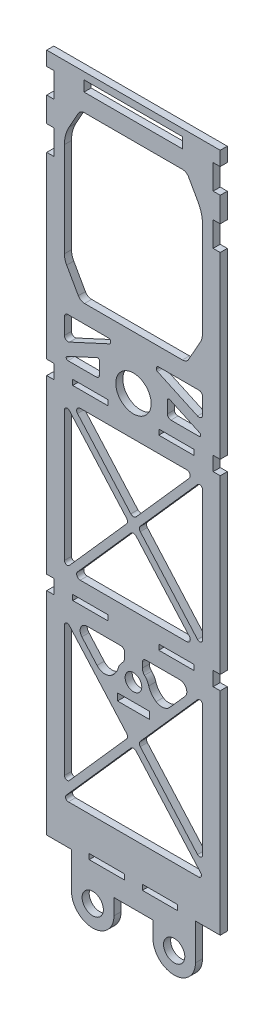
from build123d import *

# Parameters (mm, degrees)
SKETCH_1_R      = 3
SKETCH_1_R_2    = 2.35
SKETCH_1_R_3    = 5
EXTRUDE_1_DEPTH = 2


with BuildPart() as part:
    # 草图1 → 凸台-拉伸1 (new body)
    with BuildSketch(Plane.XY):
        with BuildLine():
            Line((2416.026053977, 1362.44001093), (2391.526053977, 1362.44001093))
            Line((2391.526053977, 1362.44001093), (2391.526053977, 1358.44001093))
            Line((2391.526053977, 1358.44001093), (2393.026053977, 1358.44001093))
            Line((2393.026053977, 1358.44001093), (2393.526053977, 1358.44001093))
            Line((2393.526053977, 1358.44001093), (2393.526053977, 1351.44001093))
            Line((2393.526053977, 1351.44001093), (2391.526053977, 1351.44001093))
            Line((2391.526053977, 1351.44001093), (2391.526053977, 1349.94001093))
            Line((2391.526053977, 1349.94001093), (2391.526053977, 1344.44001093))
            Line((2391.526053977, 1344.44001093), (2393.526053977, 1344.44001093))
            Line((2393.526053977, 1344.44001093), (2393.526053977, 1337.44001093))
            Line((2393.526053977, 1337.44001093), (2391.526053977, 1337.44001093))
            Line((2391.526053977, 1337.44001093), (2391.526053977, 1288.34001093))
            Line((2391.526053977, 1288.34001093), (2391.526053977, 1286.84001093))
            Line((2391.526053977, 1286.84001093), (2393.526053977, 1286.84001093))
            Line((2393.526053977, 1286.84001093), (2393.526053977, 1284.84001093))
            Line((2393.526053977, 1284.84001093), (2393.526053977, 1282.84001093))
            Line((2393.526053977, 1282.84001093), (2391.526053977, 1282.84001093))
            Line((2391.526053977, 1282.84001093), (2391.526053977, 1281.34001093))
            Line((2391.526053977, 1281.34001093), (2391.526053977, 1251.470979848))
            Line((2391.526053977, 1251.470979848), (2391.526053977, 1234.24001093))
            Line((2391.526053977, 1234.24001093), (2393.526053977, 1234.24001093))
            Line((2393.526053977, 1234.24001093), (2393.526053977, 1230.24001093))
            Line((2393.526053977, 1230.24001093), (2391.526053977, 1230.24001093))
            Line((2391.526053977, 1230.24001093), (2391.526053977, 1204.44001093))
            Line((2391.526053977, 1204.44001093), (2391.526053977, 1170.44001093))
            Line((2391.526053977, 1170.44001093), (2398.526053977, 1170.44001093))
            Line((2398.526053977, 1170.44001093), (2398.526053977, 1160.200708018))
            ThreePointArc((2398.526053977, 1160.200708018), (2404.526053977, 1154.200708018), (2410.526053977, 1160.200708018))
            Line((2410.526053977, 1160.200708018), (2410.526053977, 1164.680708018))
            Line((2410.526053977, 1164.680708018), (2416.026053977, 1164.680708018))
            Line((2416.026053977, 1164.680708018), (2421.526053977, 1164.680708018))
            Line((2421.526053977, 1164.680708018), (2421.526053977, 1160.200708018))
            ThreePointArc((2421.526053977, 1160.200708018), (2427.526053977, 1154.200708018), (2433.526053977, 1160.200708018))
            Line((2433.526053977, 1160.200708018), (2433.526053977, 1165.96001093))
            Line((2433.526053977, 1165.96001093), (2433.526053977, 1170.44001093))
            Line((2433.526053977, 1170.44001093), (2440.526053977, 1170.44001093))
            Line((2440.526053977, 1170.44001093), (2440.526053977, 1204.44001093))
            Line((2440.526053977, 1204.44001093), (2440.526053977, 1230.24001093))
            Line((2440.526053977, 1230.24001093), (2438.526053977, 1230.24001093))
            Line((2438.526053977, 1230.24001093), (2438.526053977, 1234.24001093))
            Line((2438.526053977, 1234.24001093), (2440.526053977, 1234.24001093))
            Line((2440.526053977, 1234.24001093), (2440.526053977, 1239.685823227))
            Line((2440.526053977, 1239.685823227), (2440.526053977, 1282.84001093))
            Line((2440.526053977, 1282.84001093), (2438.526053977, 1282.84001093))
            Line((2438.526053977, 1282.84001093), (2438.526053977, 1286.84001093))
            Line((2438.526053977, 1286.84001093), (2440.526053977, 1286.84001093))
            Line((2440.526053977, 1286.84001093), (2440.526053977, 1337.44001093))
            Line((2440.526053977, 1337.44001093), (2438.526053977, 1337.44001093))
            Line((2438.526053977, 1337.44001093), (2438.526053977, 1344.44001093))
            Line((2438.526053977, 1344.44001093), (2440.526053977, 1344.44001093))
            Line((2440.526053977, 1344.44001093), (2440.526053977, 1351.44001093))
            Line((2440.526053977, 1351.44001093), (2438.526053977, 1351.44001093))
            Line((2438.526053977, 1351.44001093), (2438.526053977, 1358.44001093))
            Line((2438.526053977, 1358.44001093), (2440.526053977, 1358.44001093))
            Line((2440.526053977, 1358.44001093), (2440.526053977, 1362.44001093))
            Line((2440.526053977, 1362.44001093), (2416.026053977, 1362.44001093))
        make_face()
        with Locations((2404.526053977, 1160.200708018)):
            Circle(SKETCH_1_R, mode=Mode.SUBTRACT)
        Polygon((2413.526053977, 1171.19001093), (2413.526053977, 1170.44001093), (2403.526053977, 1170.44001093), (2403.526053977, 1171.94001093), (2413.526053977, 1171.94001093), align=None, mode=Mode.SUBTRACT)
        with BuildLine():
            ThreePointArc((2396.526053977, 1224.358954227), (2397.042610992, 1225.107058547), (2397.925204163, 1224.889066531))
            Line((2397.925204163, 1224.889066531), (2414.104542733, 1206.60265131))
            ThreePointArc((2414.104542733, 1206.60265131), (2414.355605001, 1205.94001093), (2414.104542733, 1205.277370549))
            Line((2414.104542733, 1205.277370549), (2397.925204163, 1186.990955328))
            ThreePointArc((2397.925204163, 1186.990955328), (2397.042610992, 1186.772963312), (2396.526053977, 1187.521067633))
            Line((2396.526053977, 1187.521067633), (2396.526053977, 1217.24001093))
            Line((2396.526053977, 1217.24001093), (2396.526053977, 1224.358954227))
        make_face(mode=Mode.SUBTRACT)
        with BuildLine():
            Line((2434.414830968, 1181.64001093), (2416.026053977, 1181.64001093))
            Line((2416.026053977, 1181.64001093), (2397.637276986, 1181.64001093))
            ThreePointArc((2397.637276986, 1181.64001093), (2396.907862891, 1182.111445748), (2397.0381268, 1182.970123234))
            Line((2397.0381268, 1182.970123234), (2415.277116245, 1203.584422932))
            ThreePointArc((2415.277116245, 1203.584422932), (2416.026053977, 1203.921782552), (2416.774991709, 1203.584422932))
            Line((2416.774991709, 1203.584422932), (2435.013981154, 1182.970123234))
            ThreePointArc((2435.013981154, 1182.970123234), (2435.144245063, 1182.111445748), (2434.414830968, 1181.64001093))
        make_face(mode=Mode.SUBTRACT)
        Polygon((2408.867869713, 1232.24001093), (2408.867869713, 1231.49001093), (2398.867869713, 1231.49001093), (2398.867869713, 1232.99001093), (2408.867869713, 1232.99001093), align=None, mode=Mode.SUBTRACT)
        with BuildLine():
            Line((2405.74240194, 1219.072043468), (2401.45772029, 1223.914730169))
            ThreePointArc((2401.45772029, 1223.914730169), (2401.132060518, 1226.061423883), (2402.955595755, 1227.24001093))
            Line((2402.955595755, 1227.24001093), (2412.526053977, 1227.24001093))
            ThreePointArc((2412.526053977, 1227.24001093), (2413.233160758, 1226.947117711), (2413.526053977, 1226.24001093))
            Line((2413.526053977, 1226.24001093), (2413.526053977, 1224.779799278))
            ThreePointArc((2413.526053977, 1224.779799278), (2413.365786399, 1223.995334737), (2412.910669362, 1223.336594428))
            ThreePointArc((2412.910669362, 1223.336594428), (2412.176596048, 1222.419978647), (2411.704675215, 1221.344646676))
            ThreePointArc((2411.704675215, 1221.344646676), (2410.914449374, 1219.754517819), (2409.618322954, 1218.540836244))
            ThreePointArc((2409.618322954, 1218.540836244), (2407.581863615, 1218.087749149), (2405.74240194, 1219.072043468))
        make_face(mode=Mode.SUBTRACT)
        with Locations((2427.526053977, 1160.200708018)):
            Circle(SKETCH_1_R, mode=Mode.SUBTRACT)
        Polygon((2428.526053977, 1170.44001093), (2418.526053977, 1170.44001093), (2418.526053977, 1171.19001093), (2418.526053977, 1171.94001093), (2428.526053977, 1171.94001093), align=None, mode=Mode.SUBTRACT)
        with BuildLine():
            Line((2434.126903791, 1186.990955328), (2417.947565221, 1205.277370549))
            ThreePointArc((2417.947565221, 1205.277370549), (2417.696502954, 1205.94001093), (2417.947565221, 1206.60265131))
            Line((2417.947565221, 1206.60265131), (2434.126903791, 1224.889066531))
            ThreePointArc((2434.126903791, 1224.889066531), (2435.009496962, 1225.107058547), (2435.526053977, 1224.358954227))
            Line((2435.526053977, 1224.358954227), (2435.526053977, 1187.521067633))
            ThreePointArc((2435.526053977, 1187.521067633), (2435.009496962, 1186.772963312), (2434.126903791, 1186.990955328))
        make_face(mode=Mode.SUBTRACT)
        Polygon((2411.526053977, 1215.239383518), (2416.026053977, 1215.239383518), (2420.526053977, 1215.239383518), (2420.526053977, 1213.239383518), (2411.526053977, 1213.239383518), align=None, mode=Mode.SUBTRACT)
        with Locations((2416.026053977, 1220.089383518)):
            Circle(SKETCH_1_R_2, mode=Mode.SUBTRACT)
        with BuildLine():
            ThreePointArc((2429.0965122, 1227.24001093), (2430.920047437, 1226.061423883), (2430.594387664, 1223.914730169))
            Line((2430.594387664, 1223.914730169), (2426.309706014, 1219.072043468))
            ThreePointArc((2426.309706014, 1219.072043468), (2424.47024434, 1218.087749149), (2422.433785, 1218.540836244))
            ThreePointArc((2422.433785, 1218.540836244), (2421.13765858, 1219.754517819), (2420.347432739, 1221.344646676))
            ThreePointArc((2420.347432739, 1221.344646676), (2419.875511906, 1222.419978647), (2419.141438592, 1223.336594428))
            ThreePointArc((2419.141438592, 1223.336594428), (2418.686321555, 1223.995334737), (2418.526053977, 1224.779799278))
            Line((2418.526053977, 1224.779799278), (2418.526053977, 1226.24001093))
            ThreePointArc((2418.526053977, 1226.24001093), (2418.818947196, 1226.947117711), (2419.526053977, 1227.24001093))
            Line((2419.526053977, 1227.24001093), (2429.0965122, 1227.24001093))
        make_face(mode=Mode.SUBTRACT)
        Polygon((2433.184238241, 1231.49001093), (2423.184238241, 1231.49001093), (2423.184238241, 1232.24001093), (2423.184238241, 1232.99001093), (2433.184238241, 1232.99001093), align=None, mode=Mode.SUBTRACT)
        with BuildLine():
            ThreePointArc((2415.277116245, 1256.184422932), (2416.026053977, 1256.521782552), (2416.774991709, 1256.184422932))
            Line((2416.774991709, 1256.184422932), (2431.816143973, 1239.184422932))
            ThreePointArc((2431.816143973, 1239.184422932), (2431.978973859, 1238.111076075), (2431.06720624, 1237.521782552))
            Line((2431.06720624, 1237.521782552), (2416.026053977, 1237.521782552))
            Line((2416.026053977, 1237.521782552), (2400.984901714, 1237.521782552))
            ThreePointArc((2400.984901714, 1237.521782552), (2400.073134095, 1238.111076075), (2400.235963982, 1239.184422932))
            Line((2400.235963982, 1239.184422932), (2415.277116245, 1256.184422932))
        make_face(mode=Mode.SUBTRACT)
        with BuildLine():
            Line((2405.459870692, 1289.480116265), (2397.526053977, 1289.480116265))
            ThreePointArc((2397.526053977, 1289.480116265), (2397.037694512, 1289.872854749), (2397.31652527, 1290.434096133))
            Line((2397.31652527, 1290.434096133), (2405.750341985, 1294.326618329))
            ThreePointArc((2405.750341985, 1294.326618329), (2406.229347636, 1294.293806095), (2406.459870692, 1293.87263846))
            Line((2406.459870692, 1293.87263846), (2406.459870692, 1290.480116265))
            ThreePointArc((2406.459870692, 1290.480116265), (2406.166977473, 1289.773009484), (2405.459870692, 1289.480116265))
        make_face(mode=Mode.SUBTRACT)
        with BuildLine():
            Line((2396.526053977, 1295.14408702), (2396.526053977, 1299.755165))
            ThreePointArc((2396.526053977, 1299.755165), (2396.818947196, 1300.462271781), (2397.526053977, 1300.755165))
            Line((2397.526053977, 1300.755165), (2409.026053977, 1300.755165))
            ThreePointArc((2409.026053977, 1300.755165), (2409.379607368, 1300.60871839), (2409.526053977, 1300.255165))
            Line((2409.526053977, 1300.255165), (2409.526053977, 1299.901105411))
            ThreePointArc((2409.526053977, 1299.901105411), (2409.447221839, 1299.631628821), (2409.235583447, 1299.447125894))
            Line((2409.235583447, 1299.447125894), (2397.945112917, 1294.236127988))
            ThreePointArc((2397.945112917, 1294.236127988), (2396.987100797, 1294.301751298), (2396.526053977, 1295.14408702))
        make_face(mode=Mode.SUBTRACT)
        with BuildLine():
            ThreePointArc((2396.526053977, 1276.958954227), (2397.042610992, 1277.707058547), (2397.925204163, 1277.489066531))
            Line((2397.925204163, 1277.489066531), (2414.104542733, 1259.20265131))
            ThreePointArc((2414.104542733, 1259.20265131), (2414.355605001, 1258.54001093), (2414.104542733, 1257.877370549))
            Line((2414.104542733, 1257.877370549), (2397.925204163, 1239.590955328))
            ThreePointArc((2397.925204163, 1239.590955328), (2397.042610992, 1239.372963312), (2396.526053977, 1240.121067633))
            Line((2396.526053977, 1240.121067633), (2396.526053977, 1247.24001093))
            Line((2396.526053977, 1247.24001093), (2396.526053977, 1276.958954227))
        make_face(mode=Mode.SUBTRACT)
        Polygon((2408.867869713, 1284.84001093), (2408.867869713, 1284.09001093), (2398.867869713, 1284.09001093), (2398.867869713, 1285.59001093), (2408.867869713, 1285.59001093), align=None, mode=Mode.SUBTRACT)
        Polygon((2402.06486269, 1357.44001093), (2402.06486269, 1359.44001093), (2402.06486269, 1360.44001093), (2429.944930978, 1360.44001093), (2429.944930978, 1359.44001093), (2429.944930978, 1357.44001093), align=None, mode=Mode.SUBTRACT)
        with BuildLine():
            Line((2412.281365317, 1264.281494163), (2400.235963982, 1277.895598927))
            ThreePointArc((2400.235963982, 1277.895598927), (2400.073134095, 1278.968945784), (2400.984901714, 1279.558239308))
            Line((2400.984901714, 1279.558239308), (2416.026053977, 1279.558239308))
            Line((2416.026053977, 1279.558239308), (2431.06720624, 1279.558239308))
            ThreePointArc((2431.06720624, 1279.558239308), (2431.978973859, 1278.968945784), (2431.816143973, 1277.895598927))
            Line((2431.816143973, 1277.895598927), (2419.770742637, 1264.281494163))
            Line((2419.770742637, 1264.281494163), (2418.925204163, 1263.325839049))
            Line((2418.925204163, 1263.325839049), (2416.774991709, 1260.895598927))
            ThreePointArc((2416.774991709, 1260.895598927), (2416.026053977, 1260.558239308), (2415.277116245, 1260.895598927))
            Line((2415.277116245, 1260.895598927), (2413.126903791, 1263.325839049))
            Line((2413.126903791, 1263.325839049), (2412.281365317, 1264.281494163))
        make_face(mode=Mode.SUBTRACT)
        with BuildLine():
            Line((2434.126903791, 1239.590955328), (2417.947565221, 1257.877370549))
            ThreePointArc((2417.947565221, 1257.877370549), (2417.696502954, 1258.54001093), (2417.947565221, 1259.20265131))
            Line((2417.947565221, 1259.20265131), (2434.126903791, 1277.489066531))
            ThreePointArc((2434.126903791, 1277.489066531), (2435.009496962, 1277.707058547), (2435.526053977, 1276.958954227))
            Line((2435.526053977, 1276.958954227), (2435.526053977, 1240.121067633))
            ThreePointArc((2435.526053977, 1240.121067633), (2435.009496962, 1239.372963312), (2434.126903791, 1239.590955328))
        make_face(mode=Mode.SUBTRACT)
        with Locations((2416.026053977, 1290.71001093)):
            Circle(SKETCH_1_R_3, mode=Mode.SUBTRACT)
        Polygon((2433.184238241, 1284.09001093), (2423.184238241, 1284.09001093), (2423.184238241, 1284.84001093), (2423.184238241, 1285.59001093), (2433.184238241, 1285.59001093), align=None, mode=Mode.SUBTRACT)
        with BuildLine():
            ThreePointArc((2434.735582684, 1290.434096133), (2435.014413442, 1289.872854749), (2434.526053977, 1289.480116265))
            Line((2434.526053977, 1289.480116265), (2426.592237262, 1289.480116265))
            ThreePointArc((2426.592237262, 1289.480116265), (2425.885130481, 1289.773009484), (2425.592237262, 1290.480116265))
            Line((2425.592237262, 1290.480116265), (2425.592237262, 1293.87263846))
            ThreePointArc((2425.592237262, 1293.87263846), (2425.822760318, 1294.293806095), (2426.301765969, 1294.326618329))
            Line((2426.301765969, 1294.326618329), (2434.735582684, 1290.434096133))
        make_face(mode=Mode.SUBTRACT)
        with BuildLine():
            ThreePointArc((2434.526053977, 1300.755165), (2435.233160758, 1300.462271781), (2435.526053977, 1299.755165))
            Line((2435.526053977, 1299.755165), (2435.526053977, 1295.14408702))
            ThreePointArc((2435.526053977, 1295.14408702), (2435.065007157, 1294.301751298), (2434.106995037, 1294.236127988))
            Line((2434.106995037, 1294.236127988), (2422.816524507, 1299.447125894))
            ThreePointArc((2422.816524507, 1299.447125894), (2422.604886116, 1299.631628821), (2422.526053977, 1299.901105411))
            Line((2422.526053977, 1299.901105411), (2422.526053977, 1300.255165))
            ThreePointArc((2422.526053977, 1300.255165), (2422.672500586, 1300.60871839), (2423.026053977, 1300.755165))
            Line((2423.026053977, 1300.755165), (2434.526053977, 1300.755165))
        make_face(mode=Mode.SUBTRACT)
        with BuildLine():
            ThreePointArc((2397.168176291, 1312.670331375), (2396.689247777, 1313.854630949), (2396.526053977, 1315.121637573))
            Line((2396.526053977, 1315.121637573), (2396.526053977, 1329.558954227))
            Line((2396.526053977, 1329.558954227), (2396.526053977, 1334.44001093))
            Line((2396.526053977, 1334.44001093), (2396.526053977, 1341.820500095))
            ThreePointArc((2396.526053977, 1341.820500095), (2396.852441578, 1344.354513344), (2397.810298606, 1346.723112492))
            Line((2397.810298606, 1346.723112492), (2400.452597872, 1351.420533409))
            ThreePointArc((2400.452597872, 1351.420533409), (2401.186057151, 1352.166429905), (2402.195748946, 1352.44001093))
            Line((2402.195748946, 1352.44001093), (2416.026053977, 1352.44001093))
            Line((2416.026053977, 1352.44001093), (2429.856359008, 1352.44001093))
            ThreePointArc((2429.856359008, 1352.44001093), (2430.866050803, 1352.166429905), (2431.599510082, 1351.420533409))
            Line((2431.599510082, 1351.420533409), (2434.241809348, 1346.723112492))
            ThreePointArc((2434.241809348, 1346.723112492), (2435.199666377, 1344.354513344), (2435.526053977, 1341.820500095))
            Line((2435.526053977, 1341.820500095), (2435.526053977, 1334.44001093))
            Line((2435.526053977, 1334.44001093), (2435.526053977, 1329.558954227))
            Line((2435.526053977, 1329.558954227), (2435.526053977, 1329.44001093))
            Line((2435.526053977, 1329.44001093), (2435.526053977, 1315.121637573))
            ThreePointArc((2435.526053977, 1315.121637573), (2435.362860177, 1313.854630949), (2434.883931663, 1312.670331375))
            Line((2434.883931663, 1312.670331375), (2431.599510082, 1306.831359677))
            ThreePointArc((2431.599510082, 1306.831359677), (2430.866050803, 1306.085463181), (2429.856359008, 1305.811882156))
            Line((2429.856359008, 1305.811882156), (2416.026053977, 1305.811882156))
            Line((2416.026053977, 1305.811882156), (2402.195748946, 1305.811882156))
            ThreePointArc((2402.195748946, 1305.811882156), (2401.186057151, 1306.085463181), (2400.452597872, 1306.831359677))
            Line((2400.452597872, 1306.831359677), (2397.168176291, 1312.670331375))
        make_face(mode=Mode.SUBTRACT)
    extrude(amount=EXTRUDE_1_DEPTH)


solid = part.part
